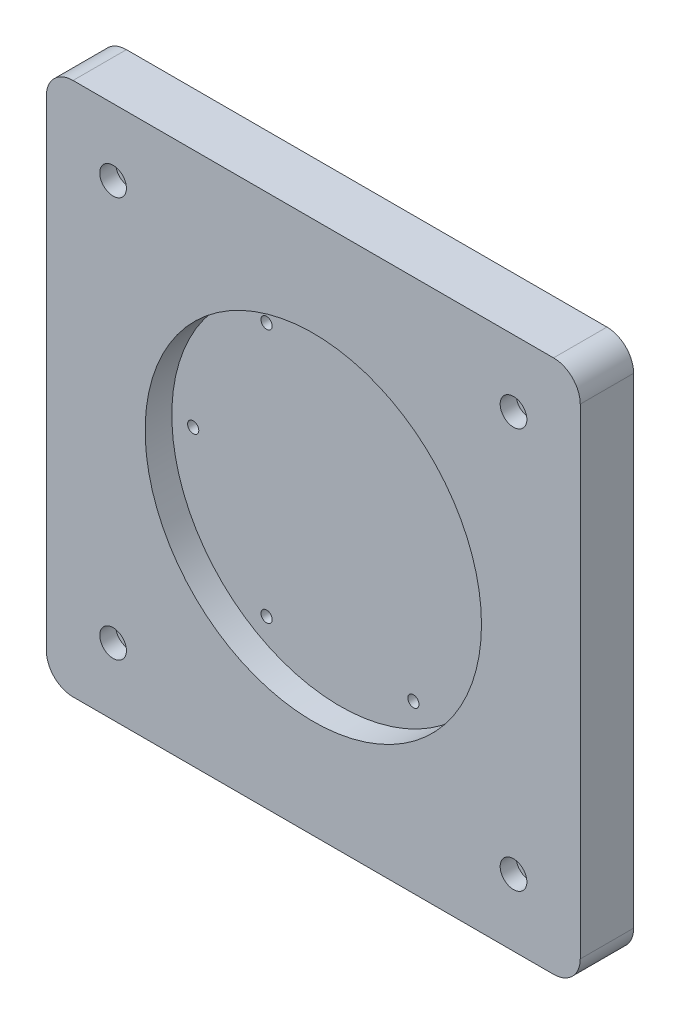
from build123d import *

# Parameters (mm, degrees)
SKETCH_1_W          = 200
SKETCH_1_H          = 200
SKETCH_1_R          = 63
EXTRUDE_1_DEPTH     = 10
SKETCH_2_W          = 200
SKETCH_2_H          = 200
EXTRUDE_2_DEPTH     = 10
SKETCH_3_R          = 2.1
CUT_EXTRUDE_1_DEPTH = 10
SKETCH_4_R          = 2.75
CUT_EXTRUDE_2_DEPTH = 143.828568571
SKETCH_5_R          = 5
CUT_EXTRUDE_3_DEPTH = 6
FILLET_1_R          = 10


with BuildPart() as part:
    # ｽｹｯﾁ1 → ﾎﾞｽ - 押し出し1 (new body)
    with BuildSketch(Plane.XY):
        Rectangle(SKETCH_1_W, SKETCH_1_H)
        Circle(SKETCH_1_R, mode=Mode.SUBTRACT)
    extrude(amount=EXTRUDE_1_DEPTH)

    # ｽｹｯﾁ2 → ﾎﾞｽ - 押し出し2 (add)
    with BuildSketch(Plane(origin=(0, 0, 0), x_dir=(-1, 0, 0), z_dir=(0, 0, -1))):
        Rectangle(SKETCH_2_W, SKETCH_2_H)
    extrude(amount=EXTRUDE_2_DEPTH)

    # ｽｹｯﾁ3 → ｶｯﾄ - 押し出し1 (cut)
    with BuildSketch(Plane.XY):
        with Locations((27.5, -47.631397208)):
            Circle(SKETCH_3_R)
        with Locations((-27.5, -47.631397208)):
            Circle(SKETCH_3_R)
        with Locations((-55, 0)):
            Circle(SKETCH_3_R)
        with Locations((-27.5, 47.631397208)):
            Circle(SKETCH_3_R)
        with Locations((27.5, 47.631397208)):
            Circle(SKETCH_3_R)
        with Locations((55, 0)):
            Circle(SKETCH_3_R)
    extrude(amount=-CUT_EXTRUDE_1_DEPTH, mode=Mode.SUBTRACT)

    # ｽｹｯﾁ4 → ｶｯﾄ - 押し出し2 (cut, through all)
    with BuildSketch(Plane.XY.offset(10)):
        with Locations((75, 75)):
            Circle(SKETCH_4_R)
        with Locations((75, -75)):
            Circle(SKETCH_4_R)
        with Locations((-75, -75)):
            Circle(SKETCH_4_R)
        with Locations((-75, 75)):
            Circle(SKETCH_4_R)
    extrude(amount=-CUT_EXTRUDE_2_DEPTH, mode=Mode.SUBTRACT)

    # ｽｹｯﾁ5 → ｶｯﾄ - 押し出し3 (cut)
    with BuildSketch(Plane.XY.offset(10)):
        with Locations((75, -75)):
            Circle(SKETCH_5_R)
        with Locations((-75, -75)):
            Circle(SKETCH_5_R)
        with Locations((-75, 75)):
            Circle(SKETCH_5_R)
        with Locations((75, 75)):
            Circle(SKETCH_5_R)
    extrude(amount=-CUT_EXTRUDE_3_DEPTH, mode=Mode.SUBTRACT)

    # ﾌｨﾚｯﾄ1
    fillet_1_edges = [part.edges().sort_by_distance(p)[0] for p in [
        (100, -100, 0),
        (-100, -100, 0),
        (-100, 100, 0),
        (100, 100, 0),
    ]]
    fillet(fillet_1_edges, radius=FILLET_1_R)


solid = part.part
